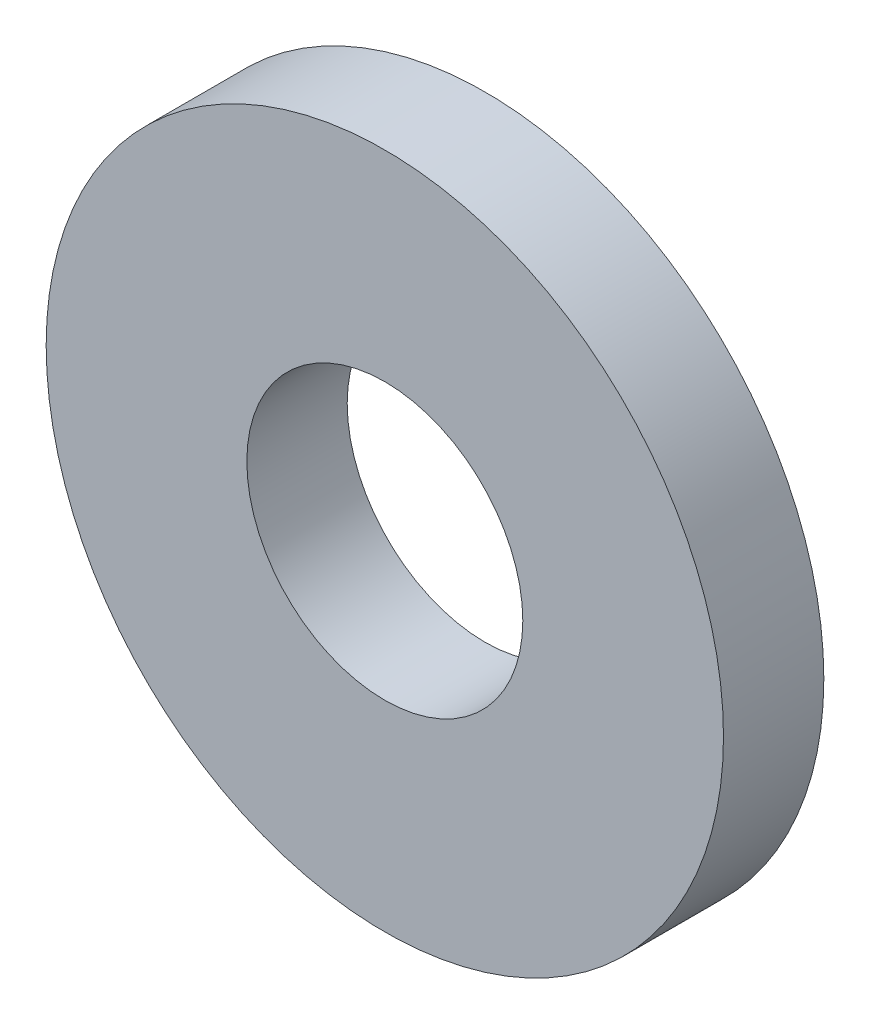
from build123d import *

# Parameters (mm, degrees)
ESQUISSE1_R      = 13.5
ESQUISSE1_R_2    = 5.5
EXTRUSION1_DEPTH = 4


with BuildPart() as part:
    # Esquisse1 → Extrusion1 (new body)
    with BuildSketch(Plane.XY):
        Circle(ESQUISSE1_R)
        Circle(ESQUISSE1_R_2, mode=Mode.SUBTRACT)
    extrude(amount=EXTRUSION1_DEPTH)


solid = part.part
